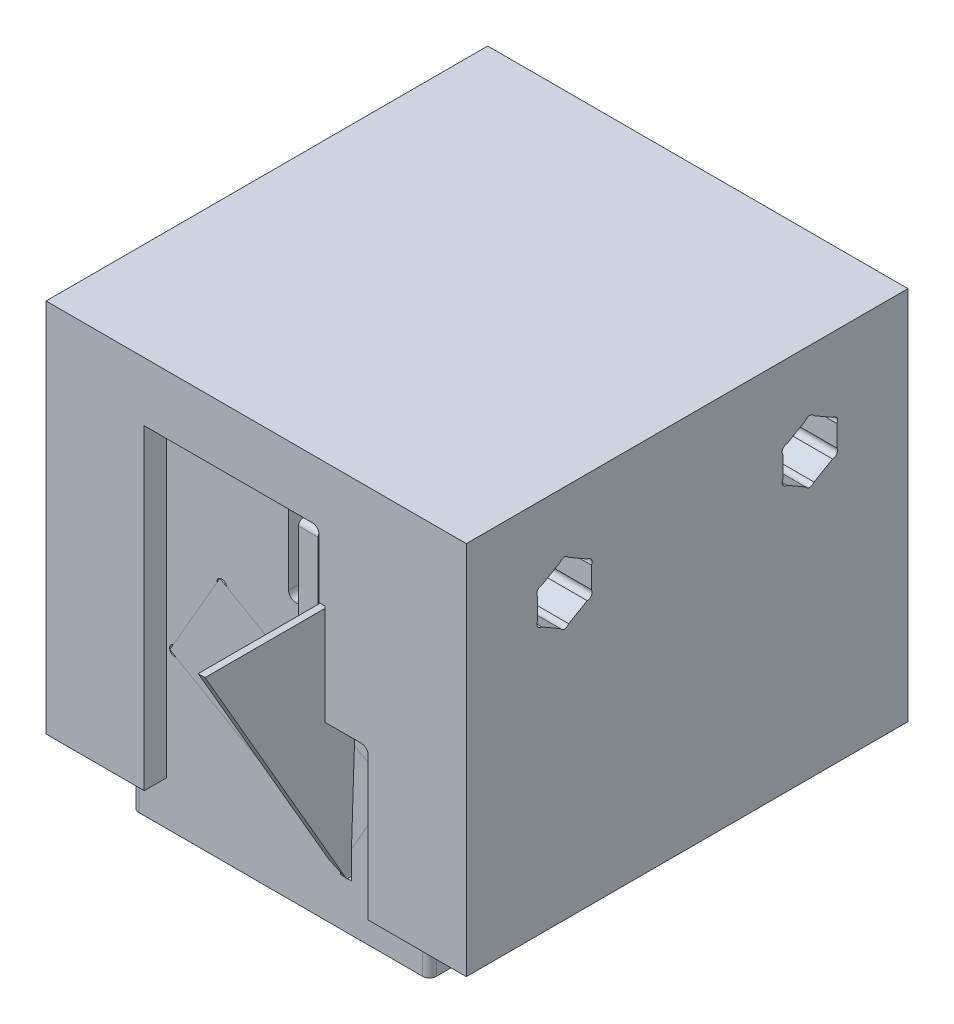
from build123d import *

# Parameters (mm, degrees)
EXTRUDE_1_DEPTH          = 20
EXTRUDE_2_DEPTH          = 22.5
CUT_EXTRUDE_1_DEPTH      = 46.176255666
CUT_EXTRUDE_1_DEPTH_BACK = 46.176255666
SKETCH_4_R               = 1.7
SKETCH_5_R               = 3
CUT_EXTRUDE_2_DEPTH      = 6
SKETCH_7_W               = 45
SKETCH_7_H               = 14.210254038
SKETCH_7_R               = 1.7
EXTRUDE_3_DEPTH          = 2
EXTRUDE_4_REACH          = 51.243
SKETCH_8_W               = 4
SKETCH_8_H               = 2.25
CUT_EXTRUDE_3_DEPTH      = 5
SKETCH_10_R              = 0.5
CUT_EXTRUDE_4_DEPTH      = 56.002839784
FILLET_1_R               = 0.7
FILLET_2_R               = 0.7
FILLET_3_R               = 0.5
EXTRUDE_5_DEPTH          = 0.7
CUT_EXTRUDE_5_DEPTH      = 68.030196212
EXTRUDE_6_DEPTH          = 40
EXTRUDE_6_2_DEPTH        = 40


with BuildPart() as part:
    # ｽｹｯﾁ2 → ﾎﾞｽ - 押し出し1 (new, symmetric)
    with BuildSketch(Plane.XY):
        Polygon((7.510254038, 4.366729559), (7.510254038, 1.552925555), (11.296856578, -0.633270441), (7.210254038, -7.711473671), (7.210254038, -10.530127019), (6.110254038, -10.530127019), (6.110254038, -9.416729559), (-11.296856578, 0.633270441), (-6.196856578, 9.466729559), (3.803143422, 3.693226867), (3.803143422, 11.198780367), (0.803143422, 11.198780367), (0.803143422, 21.330127019), (-15.160254038, 21.330127019), (-15.160254038, -15.330127019), (15.160254038, -15.330127019), (15.160254038, 4.366729559), align=None)
    extrude(amount=EXTRUDE_1_DEPTH, both=True)

    # ｽｹｯﾁ10 → ｶｯﾄ - 押し出し4 (cut, through all)
    with BuildSketch(Plane.XY.offset(20)):
        with Locations((10.79745752, -0.657777189)):
            Circle(SKETCH_10_R)
        with Locations((-6.007103249, 9.004135056)):
            Circle(SKETCH_10_R)
        with Locations((-10.813893665, 0.762679963)):
            Circle(SKETCH_10_R)
    extrude(amount=-CUT_EXTRUDE_4_DEPTH, mode=Mode.SUBTRACT)

    # ﾌｨﾚｯﾄ1
    fillet_1_edges = [part.edges().sort_by_distance(p)[0] for p in [
        (-7.178555308, 21.330127019, 20),
        (11.335254038, 4.366729559, -20),
        (15.160254038, -5.48169873, -20),
        (-15.160254038, 3, 20),
        (-15.160254038, 3, -20),
        (-7.178555308, 21.330127019, -20),
        (15.160254038, -5.48169873, 20),
        (15.160254038, 4.366729559, 0),
        (11.335254038, 4.366729559, 20),
        (-15.160254038, 21.330127019, 0),
        (0.803143422, 11.198780367, 0),
        (3.803143422, 3.693226867, 0),
    ]]
    fillet(fillet_1_edges, radius=FILLET_1_R)


with BuildPart() as body_2:
    # ｽｹｯﾁ3 → ﾎﾞｽ - 押し出し2 (new, symmetric)
    with BuildSketch(Plane.XY):
        Polygon((21.410254038, -10.633270441), (15.410254038, -10.633270441), (15.410254038, 4.616729559), (7.010254038, 4.616729559), (7.010254038, 14.869872981), (6.410254038, 14.869872981), (6.410254038, 21.580127019), (-15.410254038, 21.580127019), (-15.410254038, -10.633270441), (-21.410254038, -10.633270441), (-21.410254038, 27.580127019), (21.410254038, 27.580127019), align=None)
    extrude(amount=EXTRUDE_2_DEPTH, both=True)

    # ｽｹｯﾁ4 → ｶｯﾄ - 押し出し1 (cut, two sides: drawn at the far end of the back side and taken through both)
    with BuildSketch(Plane.ZY.offset(-6.410254038).offset(-CUT_EXTRUDE_1_DEPTH_BACK)):
        with Locations((-12.5, 18.225)):
            Circle(SKETCH_4_R)
        with Locations((12.5, 18.225)):
            Circle(SKETCH_4_R)
    extrude(amount=CUT_EXTRUDE_1_DEPTH + CUT_EXTRUDE_1_DEPTH_BACK, mode=Mode.SUBTRACT)

    # ｽｹｯﾁ5 → ｶｯﾄ - 押し出し2 (cut)
    with BuildSketch(Plane.ZY.offset(21.410254038)):
        with Locations(Location((-12.5, 18.225, 0), (0, 0, 270))):
            Circle(SKETCH_5_R)
        with Locations(Location((12.5, 18.225, 0), (0, 0, 270))):
            Circle(SKETCH_5_R)
    extrude(amount=-CUT_EXTRUDE_2_DEPTH, mode=Mode.SUBTRACT)

    # ﾎﾞｽ - 押し出し4: up to this face of the body (flat: up to its plane)
    extrude_4_end = Plane(body_2.part.faces().sort_by_distance((-4.5, 21.580127019, 0))[0])
    # ｽｹｯﾁ8 → ﾎﾞｽ - 押し出し4 (add, up to the picked face)
    with BuildSketch(Plane.XZ.offset(10.633270441), mode=Mode.PRIVATE) as extrude_4_sk1:
        with Locations((13.410254038, 21.375)):
            Rectangle(SKETCH_8_W, SKETCH_8_H)
    extrude_4_tool1 = split(extrude(extrude_4_sk1.sketch, amount=-EXTRUDE_4_REACH, mode=Mode.PRIVATE), bisect_by=extrude_4_end, keep=Keep.BOTH, mode=Mode.PRIVATE)
    # ｽｹｯﾁ8 → ﾎﾞｽ - 押し出し4 (add, up to the picked face)
    with BuildSketch(Plane.XZ.offset(10.633270441), mode=Mode.PRIVATE) as extrude_4_sk2:
        with Locations((-13.410254038, 21.375)):
            Rectangle(SKETCH_8_W, SKETCH_8_H)
    extrude_4_tool2 = split(extrude(extrude_4_sk2.sketch, amount=-EXTRUDE_4_REACH, mode=Mode.PRIVATE), bisect_by=extrude_4_end, keep=Keep.BOTH, mode=Mode.PRIVATE)
    # ｽｹｯﾁ8 → ﾎﾞｽ - 押し出し4 (add, up to the picked face)
    with BuildSketch(Plane.XZ.offset(10.633270441), mode=Mode.PRIVATE) as extrude_4_sk3:
        with Locations((-13.410254038, -21.375)):
            Rectangle(SKETCH_8_W, SKETCH_8_H)
    extrude_4_tool3 = split(extrude(extrude_4_sk3.sketch, amount=-EXTRUDE_4_REACH, mode=Mode.PRIVATE), bisect_by=extrude_4_end, keep=Keep.BOTH, mode=Mode.PRIVATE)
    # ｽｹｯﾁ8 → ﾎﾞｽ - 押し出し4 (add, up to the picked face)
    with BuildSketch(Plane.XZ.offset(10.633270441), mode=Mode.PRIVATE) as extrude_4_sk4:
        with Locations((13.410254038, -21.375)):
            Rectangle(SKETCH_8_W, SKETCH_8_H)
    extrude_4_tool4 = split(extrude(extrude_4_sk4.sketch, amount=-EXTRUDE_4_REACH, mode=Mode.PRIVATE), bisect_by=extrude_4_end, keep=Keep.BOTH, mode=Mode.PRIVATE)
    add(extrude_4_tool1.solids().sort_by(Axis((13.410254, -10.63327, 21.375), (0, 1, 0)))[0])
    add(extrude_4_tool2.solids().sort_by(Axis((-13.410254, -10.63327, 21.375), (0, 1, 0)))[0])
    add(extrude_4_tool3.solids().sort_by(Axis((-13.410254, -10.63327, -21.375), (0, 1, 0)))[0])
    add(extrude_4_tool4.solids().sort_by(Axis((13.410254, -10.63327, -21.375), (0, 1, 0)))[0])

    # ｽｹｯﾁ9 → ｶｯﾄ - 押し出し3 (cut)
    with BuildSketch(Plane(origin=(21.410254038, 0, 0), x_dir=(0, 0, -1), z_dir=(1, 0, 0))):
        with BuildLine():
            Line((-12.933012702, 21.150426481), (-14.816987298, 20.06271324))
            ThreePointArc((-14.816987298, 20.06271324), (-15.25, 19.81271324), (-15.25, 19.31271324))
            Line((-15.25, 19.31271324), (-15.25, 17.13728676))
            ThreePointArc((-15.25, 17.13728676), (-15.25, 16.63728676), (-14.816987298, 16.38728676))
            Line((-14.816987298, 16.38728676), (-12.933012702, 15.299573519))
            ThreePointArc((-12.933012702, 15.299573519), (-12.5, 15.049573519), (-12.066987298, 15.299573519))
            Line((-12.066987298, 15.299573519), (-10.183012702, 16.38728676))
            ThreePointArc((-10.183012702, 16.38728676), (-9.75, 16.63728676), (-9.75, 17.13728676))
            Line((-9.75, 17.13728676), (-9.75, 19.31271324))
            ThreePointArc((-9.75, 19.31271324), (-9.75, 19.81271324), (-10.183012702, 20.06271324))
            Line((-10.183012702, 20.06271324), (-12.066987298, 21.150426481))
            ThreePointArc((-12.066987298, 21.150426481), (-12.5, 21.400426481), (-12.933012702, 21.150426481))
        make_face()
        with BuildLine():
            Line((10.183012702, 20.06271324), (12.066987298, 21.150426481))
            ThreePointArc((12.066987298, 21.150426481), (12.5, 21.400426481), (12.933012702, 21.150426481))
            Line((12.933012702, 21.150426481), (14.816987298, 20.06271324))
            ThreePointArc((14.816987298, 20.06271324), (15.25, 19.81271324), (15.25, 19.31271324))
            Line((15.25, 19.31271324), (15.25, 17.13728676))
            ThreePointArc((15.25, 17.13728676), (15.25, 16.63728676), (14.816987298, 16.38728676))
            Line((14.816987298, 16.38728676), (12.933012702, 15.299573519))
            ThreePointArc((12.933012702, 15.299573519), (12.5, 15.049573519), (12.066987298, 15.299573519))
            Line((12.066987298, 15.299573519), (10.183012702, 16.38728676))
            ThreePointArc((10.183012702, 16.38728676), (9.75, 16.63728676), (9.75, 17.13728676))
            Line((9.75, 17.13728676), (9.75, 19.31271324))
            ThreePointArc((9.75, 19.31271324), (9.75, 19.81271324), (10.183012702, 20.06271324))
        make_face()
    extrude(amount=-CUT_EXTRUDE_3_DEPTH, mode=Mode.SUBTRACT)

    # ﾌｨﾚｯﾄ2
    fillet_2_edges = [body_2.edges().sort_by_distance(p)[0] for p in [
        (6.410254038, 21.580127019, 0),
        (-15.410254038, 5.473428289, 20.25),
        (-13.410254038, 21.580127019, 20.25),
        (-15.410254038, 5.473428289, -20.25),
        (-13.410254038, 21.580127019, -20.25),
        (-15.410254038, 21.580127019, 0),
        (13.410254038, 4.616729559, -20.25),
        (15.410254038, -3.008270441, -20.25),
        (11.410254038, 4.616729559, 21.375),
        (13.410254038, 4.616729559, 20.25),
        (15.410254038, 4.616729559, 0),
        (15.410254038, -3.008270441, 20.25),
    ]]
    fillet(fillet_2_edges, radius=FILLET_2_R)


with BuildPart() as body_3:
    # ｽｹｯﾁ7 → ﾎﾞｽ - 押し出し3 (new body)
    with BuildSketch(Plane(origin=(6.310254038, 0, 0), x_dir=(0, 0, -1), z_dir=(1, 0, 0))):
        with Locations((0, 13.975)):
            Rectangle(SKETCH_7_W, SKETCH_7_H)
        with Locations((-12.5, 18.225)):
            Circle(SKETCH_7_R, mode=Mode.SUBTRACT)
        with Locations((12.5, 18.225)):
            Circle(SKETCH_7_R, mode=Mode.SUBTRACT)
    extrude(amount=-EXTRUDE_3_DEPTH)

    # ﾌｨﾚｯﾄ3
    fillet_3_edges = [body_3.edges().sort_by_distance(p)[0] for p in [
        (5.310254038, 6.869872981, -22.5),
        (5.310254038, 6.869872981, 22.5),
        (5.310254038, 21.080127019, 22.5),
        (5.310254038, 21.080127019, -22.5),
    ]]
    fillet(fillet_3_edges, radius=FILLET_3_R)


with BuildPart() as body_4:
    # ｽｹｯﾁ11 → ﾎﾞｽ - 押し出し5 (new body)
    with BuildSketch(Plane.ZY.offset(-7.010254038)):
        Polygon((-7.281254683, 14.669872981), (-21.715011413, -10.330127019), (20.284988587, -10.330127019), (34.718745317, 14.669872981), align=None)
    extrude(amount=EXTRUDE_5_DEPTH)

    # ｽｹｯﾁ13 → ｶｯﾄ - 押し出し5 (cut, through all)
    with BuildSketch(Plane(origin=(0, 0, -22.5), x_dir=(-1, 0, 0), z_dir=(0, 0, -1))):
        Polygon((-7.010254038, -10.330127019), (-6.310254038, -8.307773445), (-6.310254038, -10.330127019), align=None)
    extrude(amount=-CUT_EXTRUDE_5_DEPTH, mode=Mode.SUBTRACT)


with BuildPart() as body_5:
    # ｽｹｯﾁ14 → ﾎﾞｽ - 押し出し6 (new body)
    with BuildSketch(Plane.XY.offset(20)):
        Polygon((-11.296856578, 0.633270441), (6.110254038, -9.416729559), (6.310254038, -9.070319398), (6.310254038, 2.245745878), (-6.196856578, 9.466729559), align=None)
    extrude(amount=-EXTRUDE_6_DEPTH)


with BuildPart() as body_6:
    # ｽｹｯﾁ14 → Extrude 6 2 (new body)
    with BuildSketch(Plane.XY.offset(20)):
        Polygon((7.510254038, 1.552925555), (7.210254038, -7.711473671), (11.296856578, -0.633270441), align=None)
    extrude(amount=-EXTRUDE_6_2_DEPTH)


solid = Compound([part.part, body_2.part, body_3.part, body_4.part, body_5.part, body_6.part])
